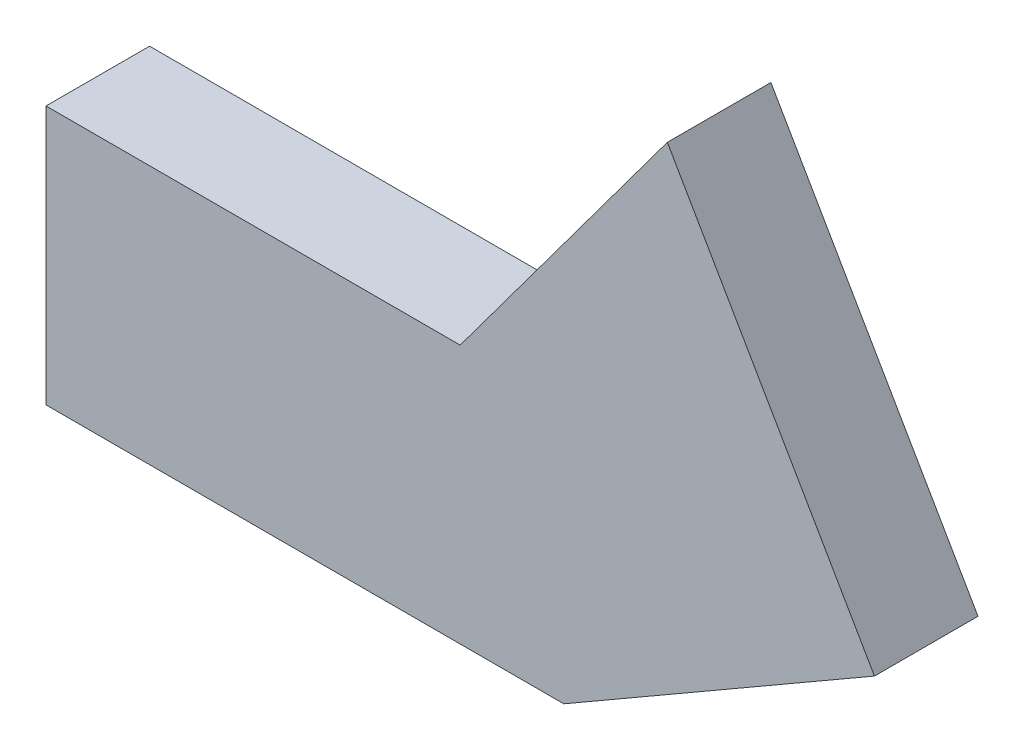
from build123d import *

# Parameters (mm, degrees)
BOSS_EXTRUDE1_DEPTH = 20


with BuildPart() as part:
    # Sketch2 → Boss-Extrude1 (new body)
    with BuildSketch(Plane.XY):
        Polygon((0, 0), (100, 0), (160, 34.641016151), (120, 103.923048454), (80, 50), (0, 50), align=None)
    extrude(amount=BOSS_EXTRUDE1_DEPTH)


solid = part.part
